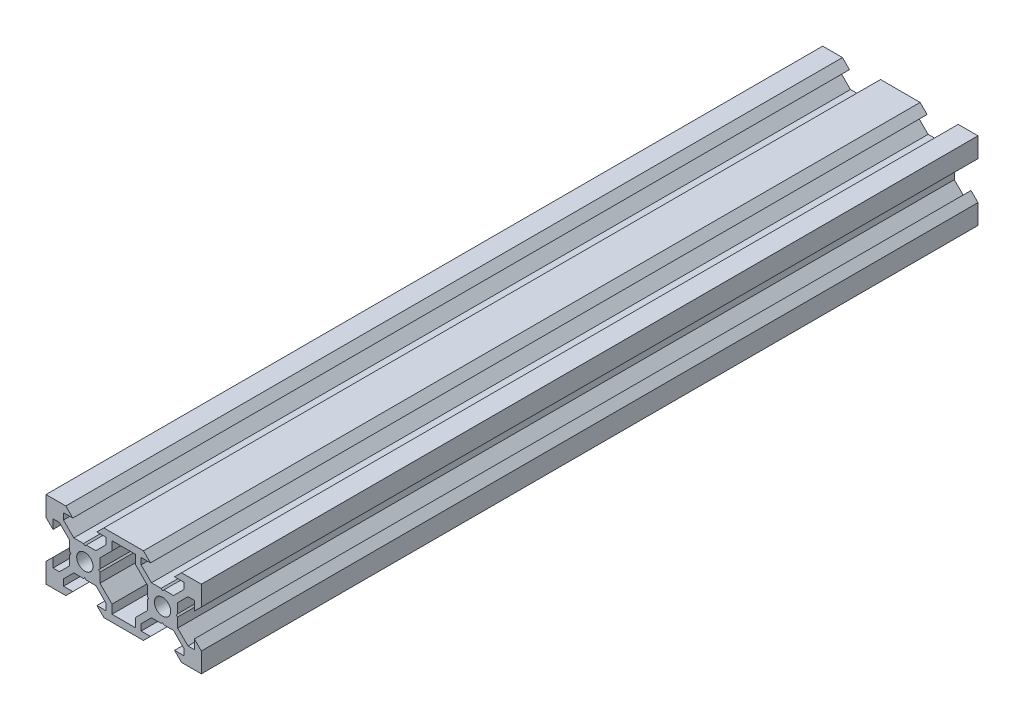
from build123d import *

# Parameters (mm, degrees)
SKETCH_1_W               = 40
SKETCH_1_H               = 20
EXTRUDE_1_DEPTH          = 200
SKETCH_2_R               = 2.1
CUT_EXTRUDE_1_DEPTH      = 202.246117975
CUT_EXTRUDE_2_DEPTH      = 202.246117975
PATTERN_CIRCULAR_1_COUNT = 4
MIRROR_1_COPY_1_DEPTH    = 202.246117975
MIRROR_1_COPY_2_DEPTH    = 202.246117975
MIRROR_1_COPY_3_DEPTH    = 202.246117975
CUT_EXTRUDE_3_DEPTH      = 202.246117975


with BuildPart() as part:
    # 草图1 → 凸台-拉伸1 (new body)
    with BuildSketch(Plane.XY):
        Rectangle(SKETCH_1_W, SKETCH_1_H)
    extrude(amount=-EXTRUDE_1_DEPTH)

    # 草图2 → 切除-拉伸1 (cut, through all)
    with BuildSketch(Plane.XY):
        with Locations((-10, 0)):
            Circle(SKETCH_2_R)
        with Locations(Location((10, 0, 0), (0, 0, 180))):
            Circle(SKETCH_2_R)
    extrude(amount=-CUT_EXTRUDE_1_DEPTH, mode=Mode.SUBTRACT)

    # 草图3 → 切除-拉伸2 (cut, through all)
    with BuildSketch(Plane.XY):
        Polygon((16.56, 5.499339828), (13.900660172, 2.84), (13.900660172, 0.353553391), (13.547106781, 0), (13.900660172, -0.353553391), (13.900660172, -2.84), (16.56, -5.499339828), (18.2, -5.499339828), (18.2, -3.1), (20, -4.9), (20, 4.9), (18.2, 3.1), (18.2, 5.499339828), align=None)
    cut_extrude_2 = extrude(amount=-CUT_EXTRUDE_2_DEPTH, mode=Mode.SUBTRACT)

    # 阵列(圆周)1: 切除-拉伸2 ×4 about axis
    pattern_circular_1_axis = Axis((10, 0, 0), (0, 0, 1))
    for i in range(1, PATTERN_CIRCULAR_1_COUNT):
        add(cut_extrude_2.rotate(pattern_circular_1_axis, i * 360 / PATTERN_CIRCULAR_1_COUNT), mode=Mode.SUBTRACT)

    # 镜向1: 切除-拉伸2 across plane
    add(cut_extrude_2.mirror(Plane(origin=(0, 0, 0), x_dir=(0, 0, 1), z_dir=(1, 0, 0))), mode=Mode.SUBTRACT)

    # 镜向1 copy 1 sketch → 镜向1 copy 1 (cut, through all)
    with BuildSketch(Plane(origin=(-10, -10, 0), x_dir=(0, 1, 0), z_dir=(0, 0, 1))):
        Polygon((16.56, -5.499339828), (13.900660172, -2.84), (13.900660172, -0.353553391), (13.547106781, 0), (13.900660172, 0.353553391), (13.900660172, 2.84), (16.56, 5.499339828), (18.2, 5.499339828), (18.2, 3.1), (20, 4.9), (20, -4.9), (18.2, -3.1), (18.2, -5.499339828), align=None)
    extrude(amount=-MIRROR_1_COPY_1_DEPTH, mode=Mode.SUBTRACT)

    # 镜向1 copy 2 sketch → 镜向1 copy 2 (cut, through all)
    with BuildSketch(Plane(origin=(-20, 0, 0), x_dir=(1, 0, 0), z_dir=(0, 0, 1))):
        Polygon((16.56, -5.499339828), (13.900660172, -2.84), (13.900660172, -0.353553391), (13.547106781, 0), (13.900660172, 0.353553391), (13.900660172, 2.84), (16.56, 5.499339828), (18.2, 5.499339828), (18.2, 3.1), (20, 4.9), (20, -4.9), (18.2, -3.1), (18.2, -5.499339828), align=None)
    extrude(amount=-MIRROR_1_COPY_2_DEPTH, mode=Mode.SUBTRACT)

    # 镜向1 copy 3 sketch → 镜向1 copy 3 (cut, through all)
    with BuildSketch(Plane(origin=(-10, 10, 0), x_dir=(0, -1, 0), z_dir=(0, 0, 1))):
        Polygon((16.56, -5.499339828), (13.900660172, -2.84), (13.900660172, -0.353553391), (13.547106781, 0), (13.900660172, 0.353553391), (13.900660172, 2.84), (16.56, 5.499339828), (18.2, 5.499339828), (18.2, 3.1), (20, 4.9), (20, -4.9), (18.2, -3.1), (18.2, -5.499339828), align=None)
    extrude(amount=-MIRROR_1_COPY_3_DEPTH, mode=Mode.SUBTRACT)

    # 草图4 → 切除-拉伸3 (cut, through all)
    with BuildSketch(Plane.XY):
        Polygon((-3.000660172, -8.2), (3.000660172, -8.2), (3.000660172, -5.938679656), (6.099339828, -2.84), (6.099339828, 2.84), (3.000660172, 5.938679656), (3.000660172, 8.2), (-3.000660172, 8.2), (-3.000660172, 5.938679656), (-6.099339828, 2.84), (-6.099339828, -2.84), (-3.000660172, -5.938679656), align=None)
    extrude(amount=-CUT_EXTRUDE_3_DEPTH, mode=Mode.SUBTRACT)


solid = part.part
